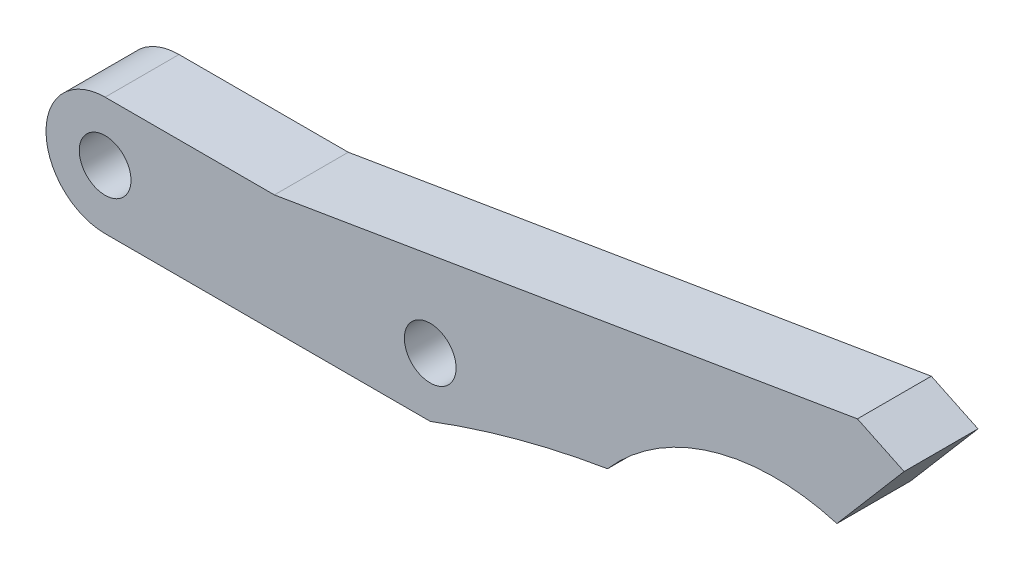
from build123d import *

# Parameters (mm, degrees)
SKETCH1_R           = 1.75
BOSS_EXTRUDE1_DEPTH = 5


with BuildPart() as part:
    # Sketch1 → Boss-Extrude1 (new body)
    with BuildSketch(Plane.XY):
        with BuildLine():
            Line((0, 4), (11.455291715, 4))
            Line((11.455291715, 4), (50.906715776, 10.601904234))
            Line((50.906715776, 10.601904234), (54.065764272, 9.095115396))
            Line((54.065764272, 9.095115396), (49.519627933, 3.772273636))
            ThreePointArc((49.519627933, 3.772273636), (41.094269374, 3.768555825), (34, -0.776553935))
            ThreePointArc((34, -0.776553935), (27.921587079, -2.096367305), (22, -4))
            Line((22, -4), (0, -4))
            ThreePointArc((0, -4), (-4, 0), (0, 4))
        make_face()
        Circle(SKETCH1_R, mode=Mode.SUBTRACT)
        with Locations((22, 0)):
            Circle(SKETCH1_R, mode=Mode.SUBTRACT)
    extrude(amount=-BOSS_EXTRUDE1_DEPTH)


solid = part.part
